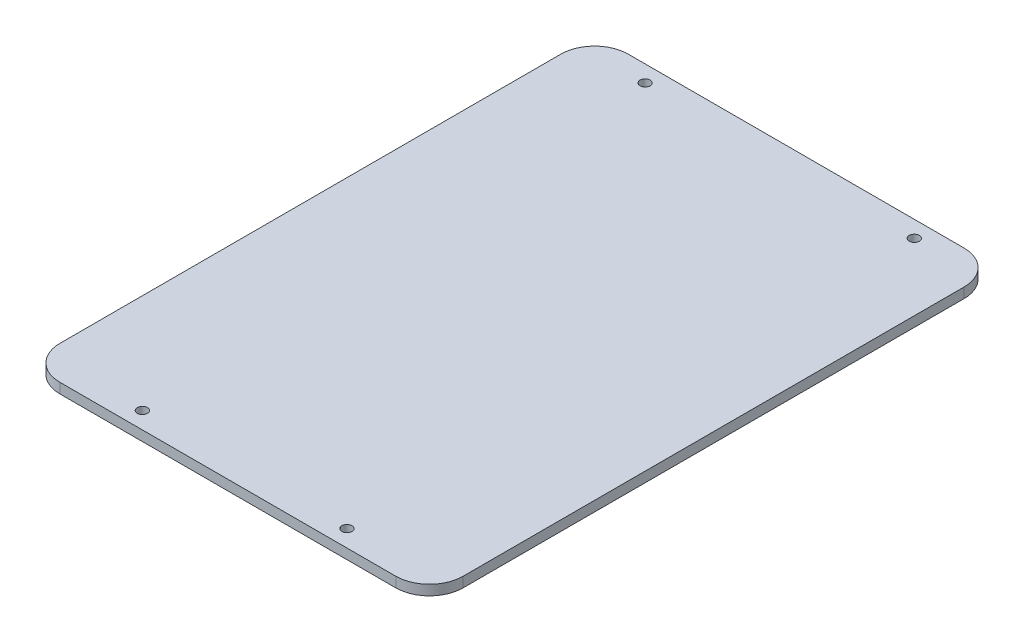
from build123d import *

# Parameters (mm, degrees)
SKETCH1_R           = 1.5
BOSS_EXTRUDE1_DEPTH = 3


with BuildPart() as part:
    # Sketch1 → Boss-Extrude1 (new body)
    with BuildSketch(Plane(origin=(0, 0, 0), x_dir=(1, 0, 0), z_dir=(0, 1, 0))):
        with BuildLine():
            Line((10, 0), (109.7, 0))
            ThreePointArc((109.7, 0), (116.771067812, 2.928932188), (119.7, 10))
            Line((119.7, 10), (119.7, 158.7))
            ThreePointArc((119.7, 158.7), (116.771067812, 165.771067812), (109.7, 168.7))
            Line((109.7, 168.7), (10, 168.7))
            ThreePointArc((10, 168.7), (2.928932188, 165.771067812), (0, 158.7))
            Line((0, 158.7), (0, 10))
            ThreePointArc((0, 10), (2.928932188, 2.928932188), (10, 0))
        make_face()
        with Locations(Location((19.9, 163.81, 0), (0, 0, 270))):
            Circle(SKETCH1_R, mode=Mode.SUBTRACT)
        with Locations(Location((29.49, 4.99, 0), (0, 0, 270))):
            Circle(SKETCH1_R, mode=Mode.SUBTRACT)
        with Locations(Location((90.21, 4.99, 0), (0, 0, 90))):
            Circle(SKETCH1_R, mode=Mode.SUBTRACT)
        with Locations(Location((99.8, 163.81, 0), (0, 0, 90))):
            Circle(SKETCH1_R, mode=Mode.SUBTRACT)
    extrude(amount=BOSS_EXTRUDE1_DEPTH)


solid = part.part
